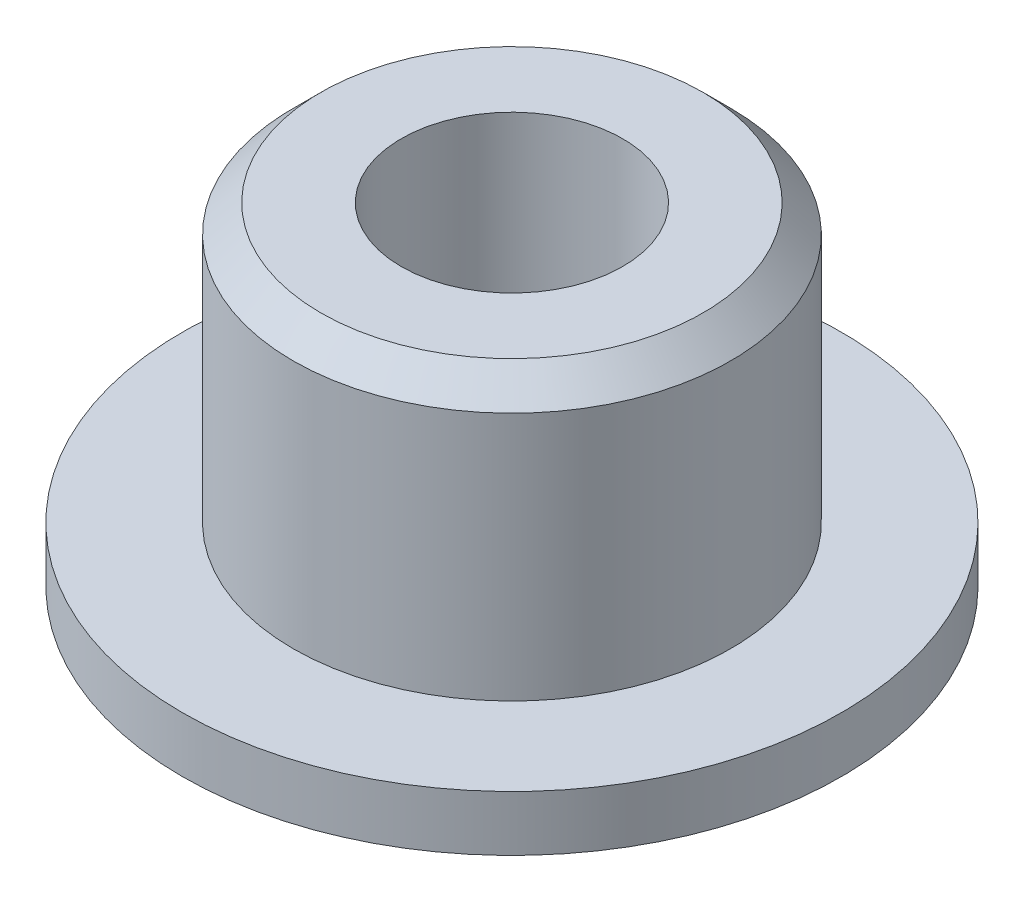
from build123d import *

# Parameters (mm, degrees)
FASE1_SIZE = 0.5
FASE2_SIZE = 0.5


with BuildPart() as part:
    # Skizze1 → Rotation1 (revolve)
    with BuildSketch(Plane.XY, mode=Mode.PRIVATE) as rotation1_sk:
        Polygon((2, 0), (2, -6), (5.95, -6), (5.95, -5), (3.95, -5), (3.95, 0), align=None)
    revolve(rotation1_sk.sketch.rotate(Axis((0, 16.559935445, 0), (0, -1, 0)), 90), axis=Axis((0, 16.559935445, 0), (0, -1, 0)))

    # Fase1
    fase1_edges = [part.edges().sort_by_distance(p)[0] for p in [
        (0, 0, -3.95),
    ]]
    chamfer(fase1_edges, length=FASE1_SIZE)

    # Fase2
    fase2_edges = [part.edges().sort_by_distance(p)[0] for p in [
        (0, -6, -2),
    ]]
    chamfer(fase2_edges, length=FASE2_SIZE)


solid = part.part
